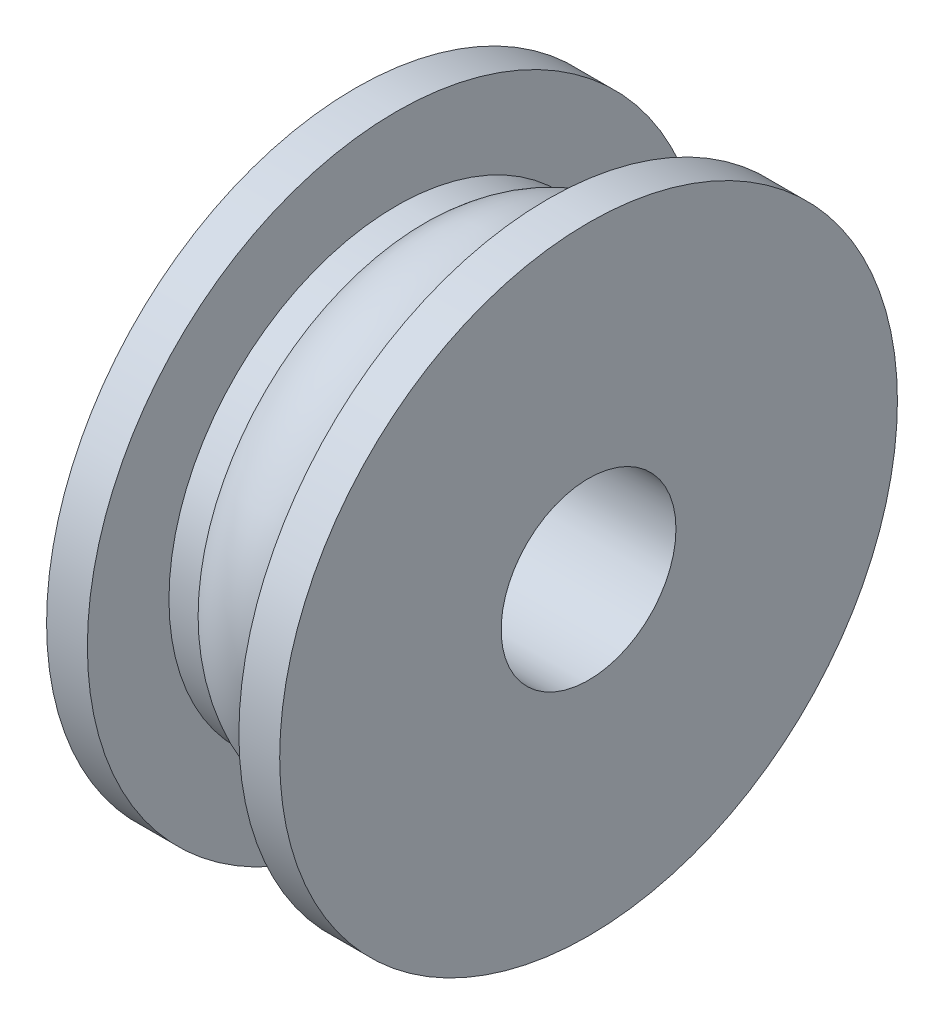
from build123d import *

# Parameters (mm, degrees)
SKETCH2_R          = 1.5
CUT_EXTRUDE1_DEPTH = 9.495881355


with BuildPart() as part:
    # Sketch1 → Revolve1 (revolve)
    with BuildSketch(Plane.XY, mode=Mode.PRIVATE) as revolve1_sk:
        with BuildLine():
            Line((0, 0), (2, 0))
            Line((2, 0), (2, 5.3))
            Line((2, 5.3), (1.3, 5.3))
            Line((1.3, 5.3), (1.3, 3.9))
            Line((1.3, 3.9), (0.8, 3.9))
            ThreePointArc((0.8, 3.9), (0, 4.203250351), (-0.8, 3.9))
            Line((-0.8, 3.9), (-1.3, 3.9))
            Line((-1.3, 3.9), (-1.3, 5.3))
            Line((-1.3, 5.3), (-2, 5.3))
            Line((-2, 5.3), (-2, 0))
            Line((-2, 0), (0, 0))
        make_face()
    revolve(revolve1_sk.sketch.rotate(Axis((0, 0, 0), (1, 0, 0)), 90), axis=Axis((0, 0, 0), (1, 0, 0)))

    # Sketch2 → Cut-Extrude1 (cut, through all)
    with BuildSketch(Plane(origin=(2, 0, 0), x_dir=(0, 0, -1), z_dir=(1, 0, 0))):
        Circle(SKETCH2_R)
    extrude(amount=-CUT_EXTRUDE1_DEPTH, mode=Mode.SUBTRACT)


solid = part.part
